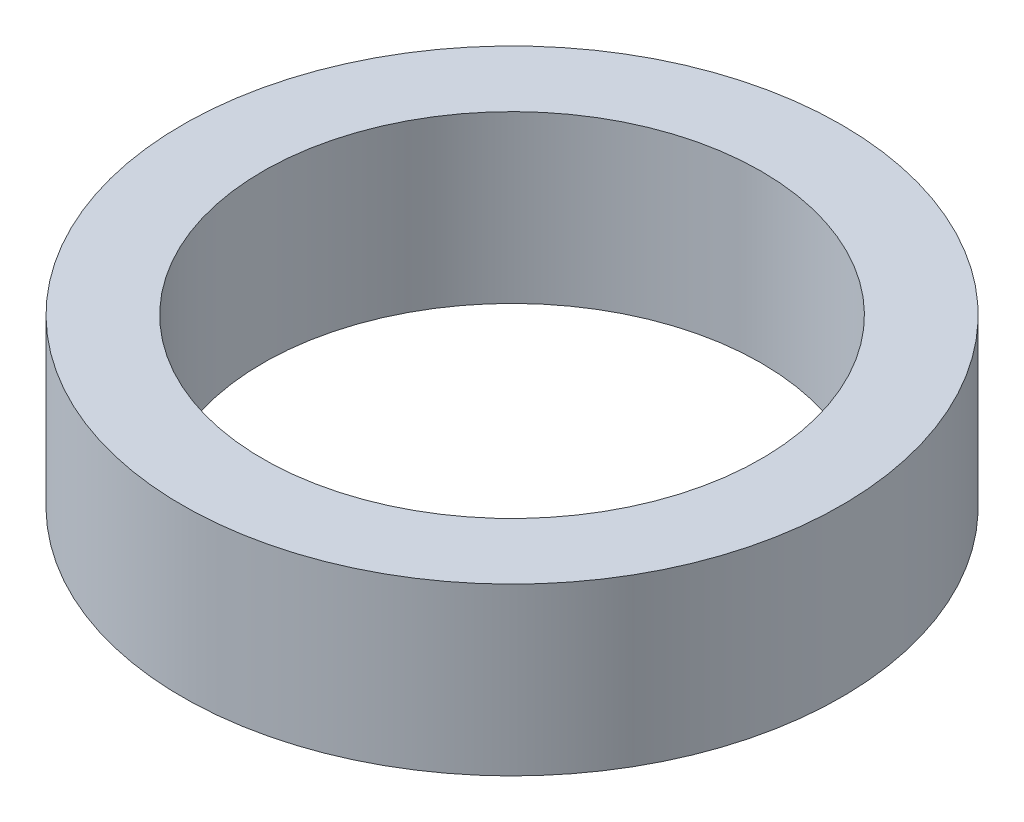
from build123d import *

# Parameters (mm, degrees)
SKETCH1_W = 0.76835
SKETCH1_H = 1.5875


with BuildPart() as part:
    # Sketch1 → Revolve1 (revolve)
    with BuildSketch(Plane.XY, mode=Mode.PRIVATE) as revolve1_sk:
        with Locations((-2.765425, 0.79375)):
            Rectangle(SKETCH1_W, SKETCH1_H)
    revolve(revolve1_sk.sketch.rotate(Axis((0, 0, 0), (0, 1, 0)), 270), axis=Axis((0, 0, 0), (0, 1, 0)))


solid = part.part
